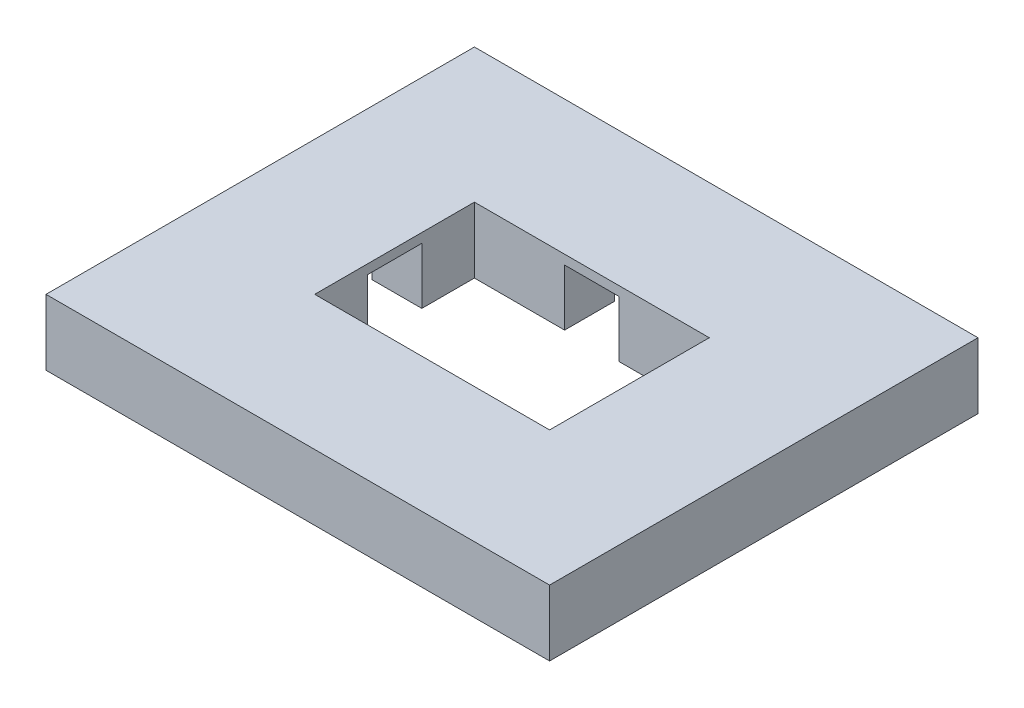
from build123d import *

# Parameters (mm, degrees)
SKETCH1_W           = 53.6
SKETCH1_H           = 45.6
SKETCH1_W_2         = 23.6
SKETCH1_H_2         = 15.6
BOSS_EXTRUDE1_DEPTH = 6
SKETCH4_W           = 11
SKETCH4_H           = 5.8
SKETCH4_W_2         = 5.8
SKETCH4_H_2         = 11
CUT_EXTRUDE1_DEPTH  = 5
CUT_EXTRUDE2_DEPTH  = 5
SKETCH6_W           = 6.037335391
SKETCH6_H           = 12.047111719
CUT_EXTRUDE3_DEPTH  = 5
BOSS_EXTRUDE3_DEPTH = 1
SKETCH8_W           = 25
SKETCH8_H           = 17
CUT_EXTRUDE4_DEPTH  = 36.875897201


with BuildPart() as part:
    # Sketch1 → Boss-Extrude1 (new body)
    with BuildSketch(Plane(origin=(0, 0, 0), x_dir=(1, 0, 0), z_dir=(0, 1, 0))):
        Rectangle(SKETCH1_W, SKETCH1_H)
        Rectangle(SKETCH1_W_2, SKETCH1_H_2, mode=Mode.SUBTRACT)
    extrude(amount=BOSS_EXTRUDE1_DEPTH)

    # Sketch4 → Cut-Extrude1 (cut)
    with BuildSketch(Plane.XZ):
        with Locations((-17.3, 0)):
            Rectangle(SKETCH4_W, SKETCH4_H)
        with Locations((0, -13.3)):
            Rectangle(SKETCH4_W_2, SKETCH4_H_2)
        with Locations((0, 13.3)):
            Rectangle(SKETCH4_W_2, SKETCH4_H_2)
        with Locations((17.3, 0)):
            Rectangle(SKETCH4_W, SKETCH4_H)
    extrude(amount=-CUT_EXTRUDE1_DEPTH, mode=Mode.SUBTRACT)

    # Sketch5 → Cut-Extrude2 (cut)
    with BuildSketch(Plane.XZ):
        Polygon((-2.9, -18.8), (-22.8, -18.8), (-22.8, -2.9), (-17.8, -2.9), (-17.8, -13.8), (-2.9, -13.8), align=None)
        Polygon((-2.9, 18.8), (-2.9, 13.8), (-17.8, 13.8), (-17.8, 2.9), (-22.8, 2.9), (-22.8, 18.8), align=None)
        Polygon((22.8, -18.8), (22.8, -2.9), (17.8, -2.9), (17.8, -13.8), (2.9, -13.8), (2.9, -18.8), align=None)
        Polygon((2.9, 18.8), (2.9, 13.8), (17.8, 13.8), (17.8, 2.9), (22.8, 2.9), (22.8, 18.8), align=None)
    extrude(amount=-CUT_EXTRUDE2_DEPTH, mode=Mode.SUBTRACT)

    # Sketch6 → Cut-Extrude3 (cut)
    with BuildSketch(Plane.XZ):
        with Locations((-25.818667696, -12.776444141)):
            Rectangle(SKETCH6_W, SKETCH6_H)
    extrude(amount=-CUT_EXTRUDE3_DEPTH, mode=Mode.SUBTRACT)

    # Sketch7 → Boss-Extrude3 (add)
    with BuildSketch(Plane.XZ):
        Polygon((22.8, -18.8), (-26.8, -18.8), (-26.8, -22.8), (26.8, -22.8), (26.8, 22.8), (-26.8, 22.8), (-26.8, -6.752888281), (-22.8, -6.752888281), (-22.8, 18.8), (22.8, 18.8), align=None)
        Polygon((-17.8, -2.9), (-17.8, -13.8), (-2.9, -13.8), (-2.9, -7.8), (-11.8, -7.8), (-11.8, -2.9), align=None)
        Polygon((-2.9, 13.8), (-17.8, 13.8), (-17.8, 2.9), (-11.8, 2.9), (-11.8, 7.8), (-2.9, 7.8), align=None)
        Polygon((2.9, -13.8), (17.8, -13.8), (17.8, -2.9), (11.8, -2.9), (11.8, -7.8), (2.9, -7.8), align=None)
        Polygon((17.8, 2.9), (17.8, 13.8), (2.9, 13.8), (2.9, 7.8), (11.8, 7.8), (11.8, 2.9), align=None)
    extrude(amount=BOSS_EXTRUDE3_DEPTH)

    # Sketch8 → Cut-Extrude4 (cut, through all)
    with BuildSketch(Plane(origin=(0, 6, 0), x_dir=(1, 0, 0), z_dir=(0, 1, 0))):
        Rectangle(SKETCH8_W, SKETCH8_H)
    extrude(amount=-CUT_EXTRUDE4_DEPTH, mode=Mode.SUBTRACT)


solid = part.part
